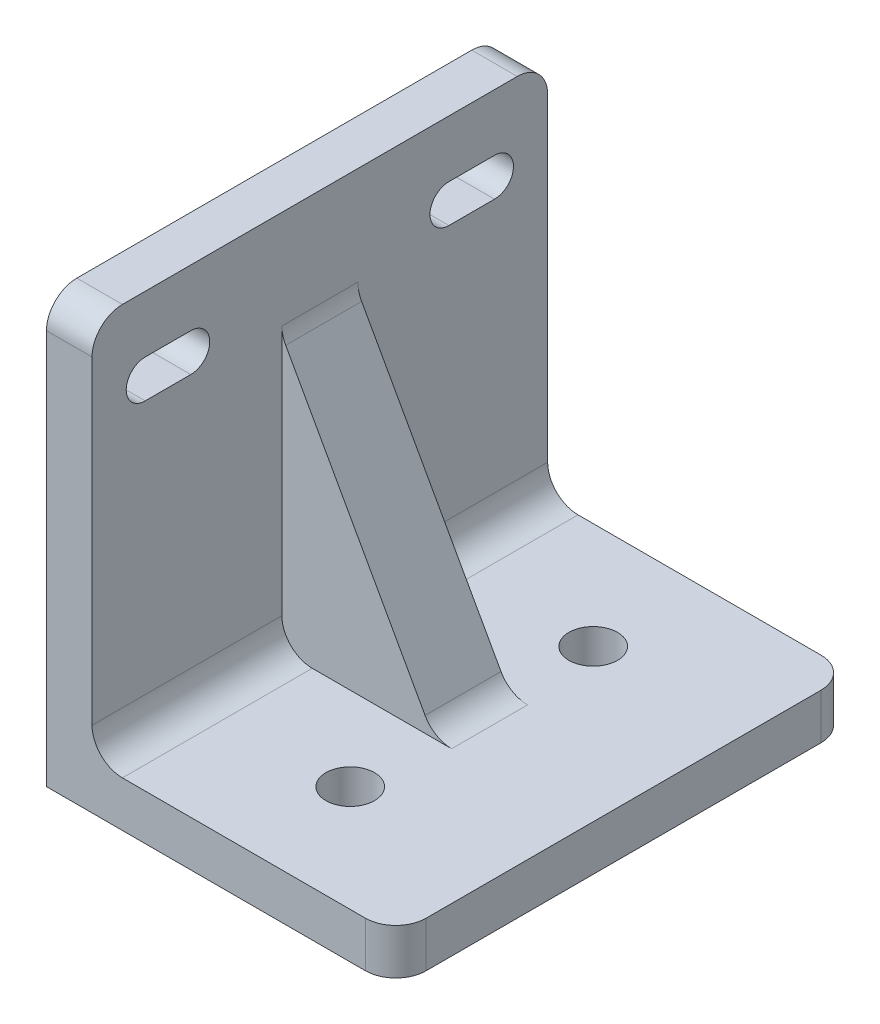
from build123d import *

# Parameters (mm, degrees)
EXTRUDE_1_DEPTH     = 15
SKETCH_2_R          = 1.6
CUT_EXTRUDE_1_DEPTH = 25
CUT_EXTRUDE_2_DEPTH = 25
RIB_1_REACH         = 37.355
SKETCH_4_WALL_W     = 93.3019384
SKETCH_4_WALL_H     = 5
FILLET_1_R          = 2


with BuildPart() as part:
    # 草图1 → 凸台-拉伸1 (new, symmetric)
    with BuildSketch(Plane.XY):
        Polygon((0, 0), (0, 25), (-3, 25), (-3, -3), (20, -3), (20, 0), align=None)
    extrude(amount=EXTRUDE_1_DEPTH, both=True)

    # 草图2 → 切除-拉伸1 (cut)
    with BuildSketch(Plane(origin=(0, 0, 0), x_dir=(1, 0, 0), z_dir=(0, 1, 0))):
        with Locations(Location((10, -8, 0), (0, 0, 180))):
            Circle(SKETCH_2_R)
        with Locations(Location((10, 8, 0), (0, 0, 180))):
            Circle(SKETCH_2_R)
    extrude(amount=-CUT_EXTRUDE_1_DEPTH, mode=Mode.SUBTRACT)

    # 草图3 → 切除-拉伸2 (cut)
    with BuildSketch(Plane.ZY.offset(3)):
        with BuildLine():
            Line((-11.5, 21.25), (-8.5, 21.25))
            ThreePointArc((-8.5, 21.25), (-7.25, 20), (-8.5, 18.75))
            Line((-8.5, 18.75), (-11.5, 18.75))
            ThreePointArc((-11.5, 18.75), (-12.75, 20), (-11.5, 21.25))
        make_face()
        with BuildLine():
            Line((11.5, 21.25), (8.5, 21.25))
            ThreePointArc((8.5, 21.25), (7.25, 20), (8.5, 18.75))
            Line((8.5, 18.75), (11.5, 18.75))
            ThreePointArc((11.5, 18.75), (12.75, 20), (11.5, 21.25))
        make_face()
    extrude(amount=-CUT_EXTRUDE_2_DEPTH, mode=Mode.SUBTRACT)

    # 草图4 wall → 筋1 (add, up to next)
    with BuildSketch(Plane(origin=(5, 9, 0), x_dir=(0.485642931179, -0.874157276122, 0), z_dir=(0.874157276122, 0.485642931179, 0)), mode=Mode.PRIVATE) as rib_1_sk1:
        Rectangle(SKETCH_4_WALL_W, SKETCH_4_WALL_H)
    rib_1_tool1 = extrude(rib_1_sk1.sketch, amount=-RIB_1_REACH, mode=Mode.PRIVATE) - part.part
    add(rib_1_tool1.solids().sort_by_distance((5, 9, 0))[0])

    # 圆角1
    fillet_1_edges = [part.edges().sort_by_distance(p)[0] for p in [
        (0, 0, 8.75),
        (-1.5, 25, 15),
        (20, -1.5, 15),
        (20, -1.5, -15),
        (0, 0, -8.75),
        (10, 0, 0),
        (-1.5, 25, -15),
        (0, 18, 0),
    ]]
    fillet(fillet_1_edges, radius=FILLET_1_R)


solid = part.part
